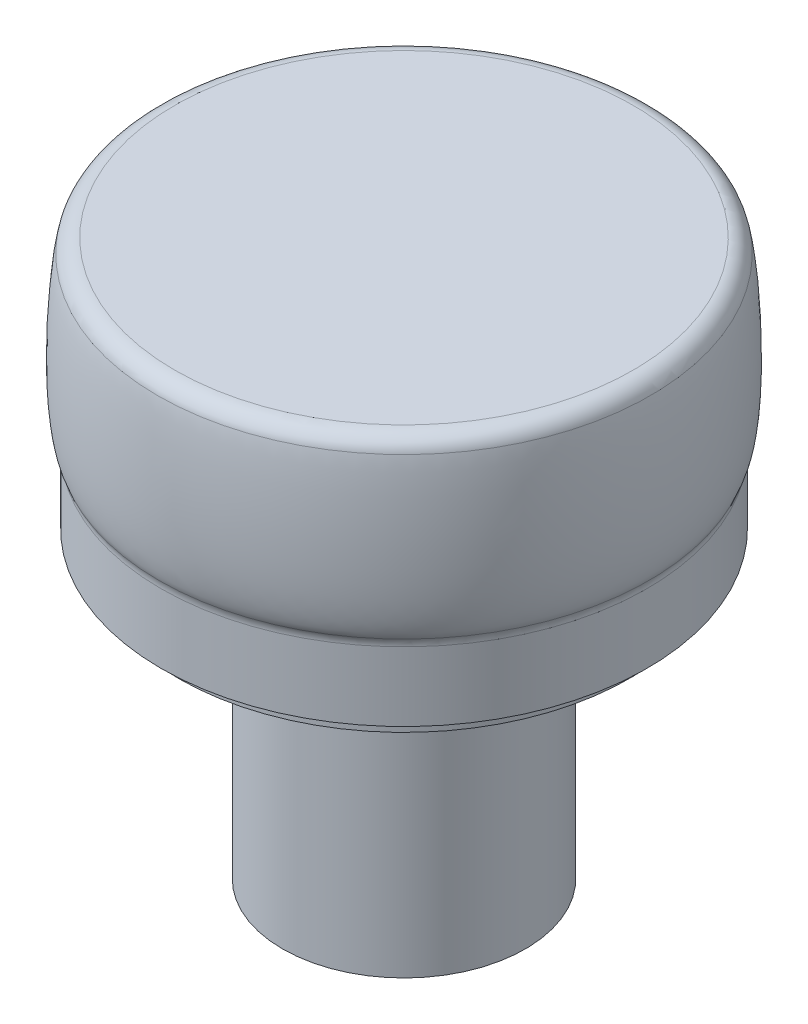
from build123d import *


with BuildPart() as part:
    # Esquisse1 → BASE (revolve)
    with BuildSketch(Plane(origin=(0, 0, 0), x_dir=(0, 0, -1), z_dir=(1, 0, 0)), mode=Mode.PRIVATE) as base_sk:
        with BuildLine():
            Line((0, 18.02020202), (0, -13.97979798))
            Line((0, -13.97979798), (7, -13.97979798))
            Line((7, -13.97979798), (7, 2.52020202))
            Line((7, 2.52020202), (13, 2.52020202))
            Line((13, 2.52020202), (13, 3.52020202))
            Line((13, 3.52020202), (14, 3.52020202))
            Line((14, 3.52020202), (14, 7.499692708))
            ThreePointArc((14, 7.499692708), (14.029220483, 7.739665891), (14.115174257, 7.965614809))
            add(Edge.make_bspline(
                [(14.194254849, 17.231489647), (14.32439859, 16.629440159), (14.692921365, 13.153711655), (14.580413451, 8.849143653), (14.115174257, 7.965614809)],
                knots=[0.108898925, 0.108898925, 0.108898925, 0.108898925, 0.358245971, 0.953924024, 0.953924024, 0.953924024, 0.953924024], degree=3))
            ThreePointArc((14.194254849, 17.231489647), (13.844808774, 17.798433228), (13.216830919, 18.02020202))
            Line((13.216830919, 18.02020202), (0, 18.02020202))
        make_face()
    revolve(base_sk.sketch.rotate(Axis((0, 23.353535354, 0), (0, -1, 0)), 180), axis=Axis((0, 23.353535354, 0), (0, -1, 0)))


solid = part.part
